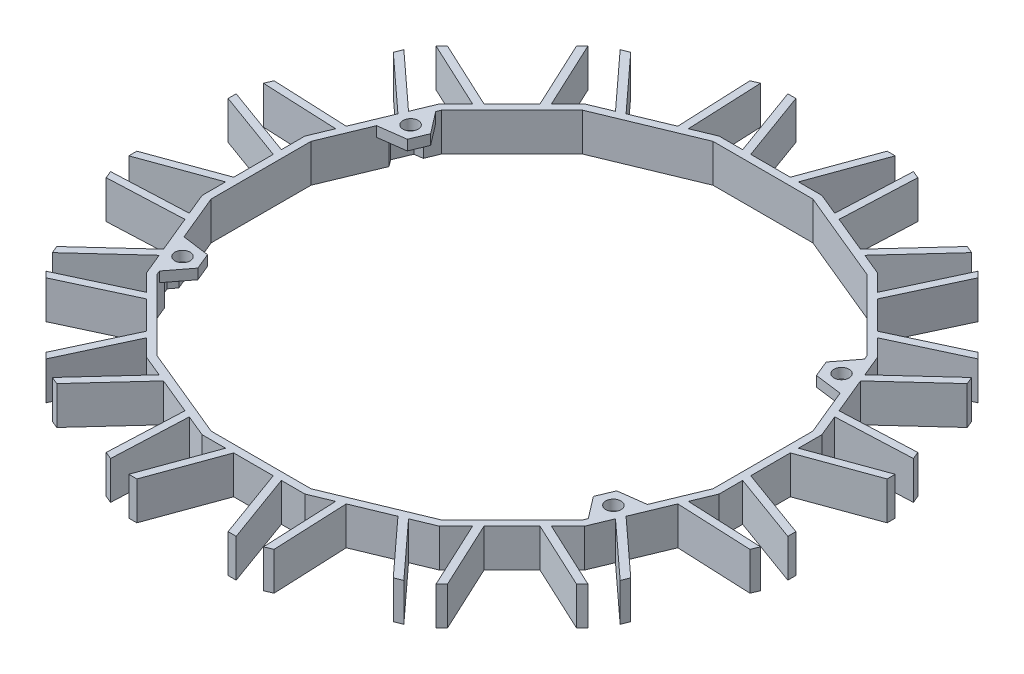
from build123d import *

# Parameters (mm, degrees)
BOSS_EXTRUDE1_DEPTH  = 1.6
BOSS_EXTRUDE5_DEPTH  = 7.5
SKETCH6_R            = 1.5
CUT_EXTRUDE2_DEPTH   = 1.6
BOSS_EXTRUDE9_DEPTH  = 7.5
CUT_EXTRUDE5_DEPTH   = 7.5
SKETCH22_R           = 1.5
BOSS_EXTRUDE12_DEPTH = 2
BOSS_EXTRUDE13_DEPTH = 2
CUT_EXTRUDE6_DEPTH   = 1.6


with BuildPart() as part:
    # Sketch1 → Boss-Extrude1 (new body)
    with BuildSketch(Plane(origin=(0, 0, 0), x_dir=(1, 0, 0), z_dir=(0, 1, 0))):
        Polygon((65, 12.92930388), (55.104339226, 36.819542328), (36.819542328, 55.104339226), (12.92930388, 65), (-12.92930388, 65), (-36.819542328, 55.104339226), (-55.104339226, 36.819542328), (-65, 12.92930388), (-65, -12.92930388), (-55.104339226, -36.819542328), (-36.819542328, -55.104339226), (-12.92930388, -65), (12.92930388, -65), (36.819542328, -55.104339226), (55.104339226, -36.819542328), (65, -12.92930388), align=None)
    extrude(amount=BOSS_EXTRUDE1_DEPTH)

    # Sketch2 → Boss-Extrude5 (add)
    with BuildSketch(Plane.XZ):
        Polygon((-9, 65), (-3.90441672, 51), (3.90441672, 51), (9, 65), (10.596266659, 65), (4.954728028, 49.5), (-4.954728028, 49.5), (-10.596266659, 65), align=None)
        Polygon((15.084749217, 64.107185308), (16.559507311, 63.496320505), (15.909644356, 48.61201175), (23.124065745, 45.623700566), (33.189338896, 56.608018722), (34.664096991, 55.997153918), (23.520401716, 43.835944531), (14.365258088, 47.628129187), align=None)
        Polygon((38.469248767, 53.454632787), (39.597979746, 52.325901808), (33.301606301, 38.82328538), (38.82328538, 33.301606301), (52.325901808, 39.597979746), (53.454632787, 38.469248767), (38.505307456, 31.498263881), (31.498263881, 38.505307456), align=None)
        Polygon((55.997153918, 34.664096991), (56.608018722, 33.189338896), (45.623700566, 23.124065745), (48.61201175, 15.909644356), (63.496320505, 16.559507311), (64.107185308, 15.084749217), (47.628129187, 14.365258088), (43.835944531, 23.520401716), align=None)
        Polygon((65, 10.596266659), (65, 9), (51, 3.90441672), (51, -3.90441672), (65, -9), (65, -10.596266659), (49.5, -4.954728028), (49.5, 4.954728028), align=None)
        Polygon((64.107185308, -15.084749217), (63.496320505, -16.559507311), (48.61201175, -15.909644356), (45.623700566, -23.124065745), (56.608018722, -33.189338896), (55.997153918, -34.664096991), (43.835944531, -23.520401716), (47.628129187, -14.365258088), align=None)
        Polygon((53.454632787, -38.469248767), (52.325901808, -39.597979746), (38.82328538, -33.301606301), (33.301606301, -38.82328538), (39.597979746, -52.325901808), (38.469248767, -53.454632787), (31.498263881, -38.505307456), (38.505307456, -31.498263881), align=None)
        Polygon((34.664096991, -55.997153918), (33.189338896, -56.608018722), (23.124065745, -45.623700566), (15.909644356, -48.61201175), (16.559507311, -63.496320505), (15.084749217, -64.107185308), (14.365258088, -47.628129187), (23.520401716, -43.835944531), align=None)
        Polygon((10.596266659, -65), (9, -65), (3.90441672, -51), (-3.90441672, -51), (-9, -65), (-10.596266659, -65), (-4.954728028, -49.5), (4.954728028, -49.5), align=None)
        Polygon((-15.084749217, -64.107185308), (-16.559507311, -63.496320505), (-15.909644356, -48.61201175), (-23.124065745, -45.623700566), (-33.189338896, -56.608018722), (-34.664096991, -55.997153918), (-23.520401716, -43.835944531), (-14.365258088, -47.628129187), align=None)
        Polygon((-38.469248767, -53.454632787), (-39.597979746, -52.325901808), (-33.301606301, -38.82328538), (-38.82328538, -33.301606301), (-52.325901808, -39.597979746), (-53.454632787, -38.469248767), (-38.505307456, -31.498263881), (-31.498263881, -38.505307456), align=None)
        Polygon((-55.997153918, -34.664096991), (-56.608018722, -33.189338896), (-45.623700566, -23.124065745), (-48.61201175, -15.909644356), (-63.496320505, -16.559507311), (-64.107185308, -15.084749217), (-47.628129187, -14.365258088), (-43.835944531, -23.520401716), align=None)
        Polygon((-65, -10.596266659), (-65, -9), (-51, -3.90441672), (-51, 3.90441672), (-65, 9), (-65, 10.596266659), (-49.5, 4.954728028), (-49.5, -4.954728028), align=None)
        Polygon((-64.107185308, 15.084749217), (-63.496320505, 16.559507311), (-48.61201175, 15.909644356), (-45.623700566, 23.124065745), (-56.608018722, 33.189338896), (-55.997153918, 34.664096991), (-43.835944531, 23.520401716), (-47.628129187, 14.365258088), align=None)
        Polygon((-53.454632787, 38.469248767), (-52.325901808, 39.597979746), (-38.82328538, 33.301606301), (-33.301606301, 38.82328538), (-39.597979746, 52.325901808), (-38.469248767, 53.454632787), (-31.498263881, 38.505307456), (-38.505307456, 31.498263881), align=None)
        Polygon((-34.664096991, 55.997153918), (-33.189338896, 56.608018722), (-23.124065745, 45.623700566), (-15.909644356, 48.61201175), (-16.559507311, 63.496320505), (-15.084749217, 64.107185308), (-14.365258088, 47.628129187), (-23.520401716, 43.835944531), align=None)
    extrude(amount=BOSS_EXTRUDE5_DEPTH)

    # Sketch6 → Cut-Extrude2 (cut)
    with BuildSketch(Plane(origin=(0, 1.6, 0), x_dir=(1, 0, 0), z_dir=(0, 1, 0))):
        with Locations(Location((-42.5, 22.5, 0), (0, 0, 270))):
            Circle(SKETCH6_R)
        with Locations(Location((-42.5, -22.5, 0), (0, 0, 270))):
            Circle(SKETCH6_R)
        with Locations(Location((42.5, -22.5, 0), (0, 0, 270))):
            Circle(SKETCH6_R)
        with Locations(Location((42.5, 22.5, 0), (0, 0, 270))):
            Circle(SKETCH6_R)
    extrude(amount=-CUT_EXTRUDE2_DEPTH, mode=Mode.SUBTRACT)

    # Sketch17 → Boss-Extrude9 (add)
    with BuildSketch(Plane.XZ.offset(7.5)):
        Polygon((-10.144530736, 51), (-28.889179365, 43.235712316), (-43.235712316, 28.889179365), (-51, 10.144530736), (-51, -10.144530736), (-43.235712316, -28.889179365), (-28.889179365, -43.235712316), (-10.144530736, -51), (10.144530736, -51), (28.889179365, -43.235712316), (43.235712316, -28.889179365), (51, -10.144530736), (51, 10.144530736), (43.235712316, 28.889179365), (28.889179365, 43.235712316), (10.144530736, 51), align=None)
        Polygon((-9.846162185, 49.5), (-28.039497619, 41.964073719), (-41.964073719, 28.039497619), (-49.5, 9.846162185), (-49.5, -9.846162185), (-41.964073719, -28.039497619), (-28.039497619, -41.964073719), (-9.846162185, -49.5), (9.846162185, -49.5), (28.039497619, -41.964073719), (41.964073719, -28.039497619), (49.5, -9.846162185), (49.5, 9.846162185), (41.964073719, 28.039497619), (28.039497619, 41.964073719), (9.846162185, 49.5), align=None, mode=Mode.SUBTRACT)
    extrude(amount=-BOSS_EXTRUDE9_DEPTH)

    # Sketch16 → Cut-Extrude5 (cut)
    with BuildSketch(Plane.XZ.offset(7.5)):
        Polygon((-43.847748534, 19.24624721), (-40.356041693, 19.705939136), (-39.008293159, 22.959691927), (-41.152251466, 25.75375279), (-44.643958307, 25.294060864), (-45.991706841, 22.040308073), align=None)
        Polygon((45.991706841, 22.040308073), (43.847748534, 19.24624721), (40.356041693, 19.705939136), (39.008293159, 22.959691927), (41.152251466, 25.75375279), (44.643958307, 25.294060864), align=None)
        Polygon((44.643958307, -25.294060864), (45.991706841, -22.040308073), (43.847748534, -19.24624721), (40.356041693, -19.705939136), (39.008293159, -22.959691927), (41.152251466, -25.75375279), align=None)
        Polygon((-45.991706841, -22.040308073), (-43.847748534, -19.24624721), (-40.356041693, -19.705939136), (-39.008293159, -22.959691927), (-41.152251466, -25.75375279), (-44.643958307, -25.294060864), align=None)
    extrude(amount=-CUT_EXTRUDE5_DEPTH, mode=Mode.SUBTRACT)

    # Sketch22 → Boss-Extrude12 (add)
    # profile 1 of 4: a face of its own
    with BuildSketch(Plane.XZ):
        Polygon((44.643958307, 25.294060864), (41.152251466, 25.75375279), (39.008293159, 22.959691927), (40.356041693, 19.705939136), (43.847748534, 19.24624721), (45.991706841, 22.040308073), align=None)
        with Locations(Location((42.5, 22.5, 0), (0, 0, 90))):
            Circle(SKETCH22_R, mode=Mode.SUBTRACT)
    # profile 2 of 4: a face of its own
    with BuildSketch(Plane.XZ):
        Polygon((-45.991706841, 22.040308073), (-44.643958307, 25.294060864), (-41.152251466, 25.75375279), (-39.008293159, 22.959691927), (-40.356041693, 19.705939136), (-43.847748534, 19.24624721), align=None)
        with Locations(Location((-42.5, 22.5, 0), (0, 0, 90))):
            Circle(SKETCH22_R, mode=Mode.SUBTRACT)
    # profile 3 of 4: a face of its own
    with BuildSketch(Plane.XZ):
        Polygon((-44.643958307, -25.294060864), (-41.152251466, -25.75375279), (-39.008293159, -22.959691927), (-40.356041693, -19.705939136), (-43.847748534, -19.24624721), (-45.991706841, -22.040308073), align=None)
        with Locations(Location((-42.5, -22.5, 0), (0, 0, 90))):
            Circle(SKETCH22_R, mode=Mode.SUBTRACT)
    # profile 4 of 4: a face of its own
    with BuildSketch(Plane.XZ):
        Polygon((45.991706841, -22.040308073), (44.643958307, -25.294060864), (41.152251466, -25.75375279), (39.008293159, -22.959691927), (40.356041693, -19.705939136), (43.847748534, -19.24624721), align=None)
        with Locations(Location((42.5, -22.5, 0), (0, 0, 90))):
            Circle(SKETCH22_R, mode=Mode.SUBTRACT)
    extrude(amount=BOSS_EXTRUDE12_DEPTH)

    # Sketch23 → Boss-Extrude13 (add)
    with BuildSketch(Plane.XZ.offset(2)):
        Polygon((-41.152251466, 25.75375279), (-42.294343426, 27.242156012), (-43.012292446, 25.50887375), align=None)
        Polygon((-43.847748534, 19.24624721), (-45.707789515, 19.001368169), (-44.989840495, 20.734650431), align=None)
        Polygon((-43.847748534, -19.24624721), (-45.707789515, -19.001368169), (-44.989840495, -20.734650431), align=None)
        Polygon((-42.294343426, -27.242156012), (-43.012292446, -25.50887375), (-41.152251466, -25.75375279), align=None)
        Polygon((43.012292446, -25.50887375), (41.152251466, -25.75375279), (42.294343426, -27.242156012), align=None)
        Polygon((45.707789515, -19.001368169), (44.989840495, -20.734650431), (43.847748534, -19.24624721), align=None)
        Polygon((45.707789515, 19.001368169), (44.989840495, 20.734650431), (43.847748534, 19.24624721), align=None)
        Polygon((43.012292446, 25.50887375), (41.152251466, 25.75375279), (42.294343426, 27.242156012), align=None)
    extrude(amount=-BOSS_EXTRUDE13_DEPTH)

    # Sketch18 → Cut-Extrude6 (cut)
    with BuildSketch(Plane(origin=(0, 1.6, 0), x_dir=(1, 0, 0), z_dir=(0, 1, 0))):
        Polygon((-36.819542328, 55.104339226), (-55.104339226, 36.819542328), (-65, 12.92930388), (-65, -12.92930388), (-55.104339226, -36.819542328), (-36.819542328, -55.104339226), (-12.92930388, -65), (12.92930388, -65), (36.819542328, -55.104339226), (55.104339226, -36.819542328), (65, -12.92930388), (65, 12.92930388), (55.104339226, 36.819542328), (36.819542328, 55.104339226), (12.92930388, 65), (-12.92930388, 65), align=None)
    extrude(amount=-CUT_EXTRUDE6_DEPTH, mode=Mode.SUBTRACT)


solid = part.part
